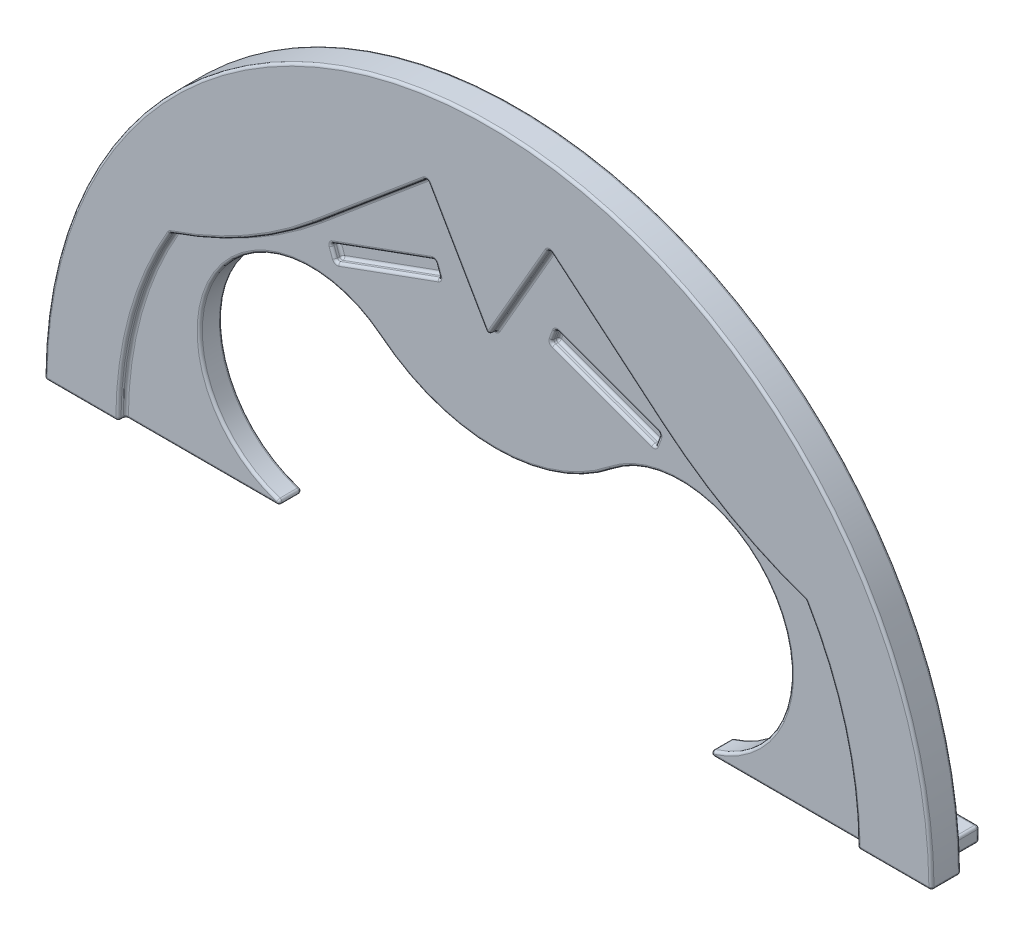
from build123d import *

# Parameters (mm, degrees)
EXTRUDE_1_DEPTH              = 6
SKETCH_2_W                   = 20
SKETCH_2_H                   = 4
EXTRUDE_2_DEPTH              = 10
HOLE_WIZARD_M2_1_D           = 2.2
HOLE_WIZARD_M2_1_CBORE_D     = 4.6
HOLE_WIZARD_M2_1_CBORE_DEPTH = 2
CUT_EXTRUDE_1_REACH          = 172.458
CUT_EXTRUDE_2_DEPTH          = 2
EXTRUDE_3_DEPTH              = 2
FILLET_1_R                   = 0.7
FILLET_2_R                   = 0.3


with BuildPart() as part:
    # 草图1 → 凸台-拉伸1 (new body)
    with BuildSketch(Plane.XY):
        with BuildLine():
            Line((-120, 0), (120, 0))
            ThreePointArc((120, 0), (0, 120), (-120, 0))
        make_face()
    extrude(amount=EXTRUDE_1_DEPTH)

    # 草图2 → 凸台-拉伸2 (add)
    with BuildSketch(Plane(origin=(0, 0, 0), x_dir=(-1, 0, 0), z_dir=(0, 0, -1))):
        with Locations((-105, 2)):
            Rectangle(SKETCH_2_W, SKETCH_2_H)
    extrude_2 = extrude(amount=EXTRUDE_2_DEPTH)

    # 镜向1: 凸台-拉伸2 across plane
    add(extrude_2.mirror(Plane(origin=(0, 0, 0), x_dir=(0, 0, 1), z_dir=(1, 0, 0))))

    # M2 六角头机械螺钉的柱形沉头孔1 (through all)
    with Locations(Plane(origin=(0, 4, 0), x_dir=(1, 0, 0), z_dir=(0, 1, 0))):
        with Locations((-110, 5), (110, 5), (100, 5), (-100, 5)):
            CounterBoreHole(HOLE_WIZARD_M2_1_D / 2, HOLE_WIZARD_M2_1_CBORE_D / 2, HOLE_WIZARD_M2_1_CBORE_DEPTH)

    # 草图6 → 切除-拉伸1 (cut, up to next)
    with BuildSketch(Plane.XY.offset(6), mode=Mode.PRIVATE) as cut_extrude_1_sk1:
        with BuildLine():
            Line((-50, 0), (50, 0))
            ThreePointArc((50, 0), (78.306909711, 39.935736641), (31.25, 53.418742494))
            ThreePointArc((31.25, 53.418742494), (0, 42.449979984), (-31.25, 53.418742494))
            ThreePointArc((-31.25, 53.418742494), (-78.306909711, 39.935736641), (-50, 0))
        make_face()
    cut_extrude_1_tool1 = extrude(cut_extrude_1_sk1.sketch, amount=-CUT_EXTRUDE_1_REACH, mode=Mode.PRIVATE) & part.part
    add(cut_extrude_1_tool1.solids().sort_by_distance((0, 27.195385, 6))[0], mode=Mode.SUBTRACT)

    # 草图8 → 切除-拉伸2 (cut)
    with BuildSketch(Plane.XY.offset(6)):
        Polygon((-16.368080573, 78.758770483), (-44.558859197, 68.498166183), (-43.190778624, 64.7393957), (-15, 75), align=None)
        Polygon((43.190778624, 64.7393957), (15, 75), (16.368080573, 78.758770483), (44.558859197, 68.498166183), align=None)
    extrude(amount=-CUT_EXTRUDE_2_DEPTH, mode=Mode.SUBTRACT)

    # 草图10 → 凸台-拉伸3 (add)
    with BuildSketch(Plane.XY.offset(6)):
        with BuildLine():
            Line((-120, 0), (-100, 0))
            ThreePointArc((-100, 0), (-96.419849408, 26.518156802), (-85.935747196, 51.137533709))
            ThreePointArc((-85.935747196, 51.137533709), (-65.534655314, 60.214189596), (-47.16837358, 72.91339931))
            Line((-47.16837358, 72.91339931), (-16.526595856, 98.624903698))
            Line((-16.526595856, 98.624903698), (0, 70))
            Line((0, 70), (16.526595856, 98.624903698))
            Line((16.526595856, 98.624903698), (47.16837358, 72.91339931))
            ThreePointArc((47.16837358, 72.91339931), (65.534655314, 60.214189596), (85.935747196, 51.137533709))
            ThreePointArc((85.935747196, 51.137533709), (96.419849408, 26.518156802), (100, 0))
            Line((100, 0), (120, 0))
            ThreePointArc((120, 0), (0, 120), (-120, 0))
        make_face()
    extrude(amount=EXTRUDE_3_DEPTH)

    # 圆角1
    fillet_1_edges = [part.edges().sort_by_distance(p)[0] for p in [
        (115, 2, 0),
        (115, 4, -5),
        (-75, 0, 6),
        (115, 0, -5),
        (95, 2, 0),
        (-96.419849408, 26.518156802, 6),
        (-100, 0, 7),
        (-65.534655314, 60.214189596, 6),
        (-85.935747196, 51.137533709, 7),
        (-31.847484718, 85.769151504, 6),
        (-8.263297928, 84.312451849, 6),
        (-16.526595856, 98.624903698, 7),
        (8.263297928, 84.312451849, 6),
        (95, 0, -5),
        (0, 70, 7),
        (31.847484718, 85.769151504, 6),
        (16.526595856, 98.624903698, 7),
        (65.534655314, 60.214189596, 6),
        (96.419849408, 26.518156802, 6),
        (105, 4, 0),
        (85.935747196, 51.137533709, 7),
        (100, 0, 7),
        (-96.419849408, 26.518156802, 8),
        (-65.534655314, 60.214189596, 8),
        (-31.847484718, 85.769151504, 8),
        (-8.263297928, 84.312451849, 8),
        (8.263297928, 84.312451849, 8),
        (95, 4, -5),
        (31.847484718, 85.769151504, 8),
        (65.534655314, 60.214189596, 8),
        (96.419849408, 26.518156802, 8),
        (110, 0, 8),
        (115, 2, -10),
        (0, 120, 8),
        (-110, 0, 8),
        (105, 0, -10),
        (95, 2, -10),
        (105, 4, -10),
        (-72.5, 0, 0),
        (-115, 2, -10),
        (-115, 0, -5),
        (-105, 4, -10),
        (-115, 4, -5),
        (-95, 2, -10),
        (-95, 4, -5),
        (-105, 0, -10),
        (-95, 0, -5),
        (-115, 2, 0),
        (-95, 2, 0),
        (-105, 4, 0),
        (-117.5, 0, 0),
        (0, 120, 0),
        (120, 0, 4),
        (-120, 0, 4),
        (75, 0, 6),
        (72.5, 0, 0),
        (-50, 0, 3),
        (50, 0, 3),
        (-78.306909711, 39.935736641, 6),
        (78.306909711, 39.935736641, 6),
        (0, 42.449979984, 6),
        (-78.306909711, 39.935736641, 0),
        (0, 42.449979984, 0),
        (78.306909711, 39.935736641, 0),
        (-15.684040287, 76.879385242, 4),
        (-16.368080573, 78.758770483, 5),
        (-29.095389312, 69.86969785, 4),
        (-15, 75, 5),
        (-43.87481891, 66.618780942, 4),
        (-43.190778624, 64.7393957, 5),
        (-30.463469885, 73.628468333, 4),
        (-44.558859197, 68.498166183, 5),
        (-15.684040287, 76.879385242, 6),
        (-30.463469885, 73.628468333, 6),
        (-43.87481891, 66.618780942, 6),
        (-29.095389312, 69.86969785, 6),
        (117.5, 0, 0),
        (43.87481891, 66.618780942, 4),
        (44.558859197, 68.498166183, 5),
        (29.095389312, 69.86969785, 4),
        (43.190778624, 64.7393957, 5),
        (15.684040287, 76.879385242, 4),
        (15, 75, 5),
        (30.463469885, 73.628468333, 4),
        (16.368080573, 78.758770483, 5),
        (43.87481891, 66.618780942, 6),
        (30.463469885, 73.628468333, 6),
        (15.684040287, 76.879385242, 6),
        (29.095389312, 69.86969785, 6),
    ]]
    fillet(fillet_1_edges, radius=FILLET_1_R)

    # 圆角2
    fillet_2_edges = [part.edges().sort_by_distance(p)[0] for p in [
        (-102.3, 4, -5),
        (97.7, 4, -5),
        (107.7, 4, -5),
        (-112.3, 4, -5),
    ]]
    fillet(fillet_2_edges, radius=FILLET_2_R)


solid = part.part
